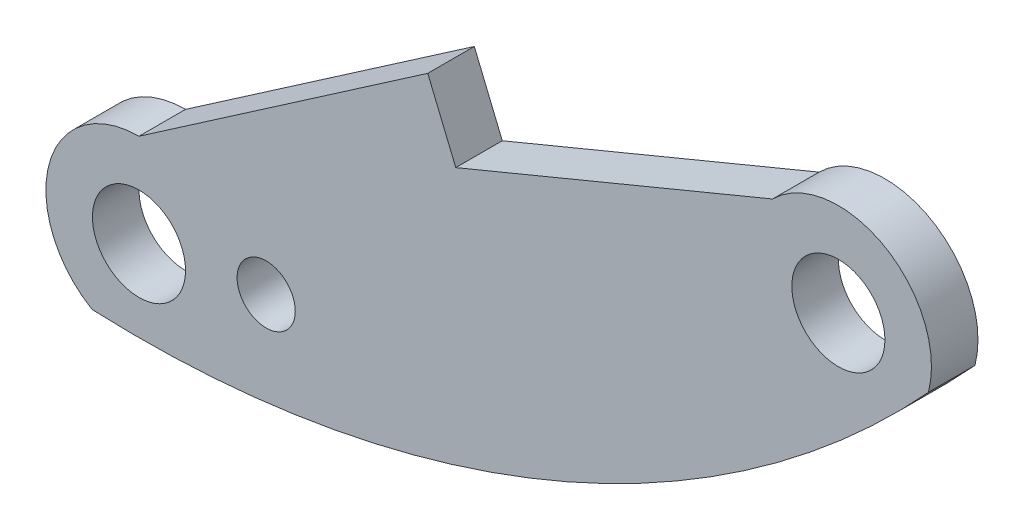
from build123d import *

# Parameters (mm, degrees)
SKETCH_1_R      = 2
SKETCH_1_R_2    = 1.25
EXTRUDE_1_DEPTH = 2


with BuildPart() as part:
    # 草图1 → 凸台-拉伸1 (new body)
    with BuildSketch(Plane.XY):
        with BuildLine():
            Line((12.667014152, -29.085004895), (0.259047619, -37.62952381))
            ThreePointArc((0.259047619, -37.62952381), (-3.602527799, -40.586338642), (-1.755121481, -45.085406162))
            ThreePointArc((-1.755121481, -45.085406162), (17.862485508, -41.627982305), (34.178996295, -30.201007228))
            ThreePointArc((34.178996295, -30.201007228), (32.303988677, -25.71337254), (27.482658695, -26.353134885))
            Line((27.482658695, -26.353134885), (13.870853157, -31.991329347))
            Line((13.870853157, -31.991329347), (12.667014152, -29.085004895))
        make_face()
        with Locations((0.259047619, -41.62952381)):
            Circle(SKETCH_1_R, mode=Mode.SUBTRACT)
        with Locations((30.311085819, -29.18156201)):
            Circle(SKETCH_1_R, mode=Mode.SUBTRACT)
        with Locations((5.724004276, -40.783180011)):
            Circle(SKETCH_1_R_2, mode=Mode.SUBTRACT)
    extrude(amount=EXTRUDE_1_DEPTH)


solid = part.part
